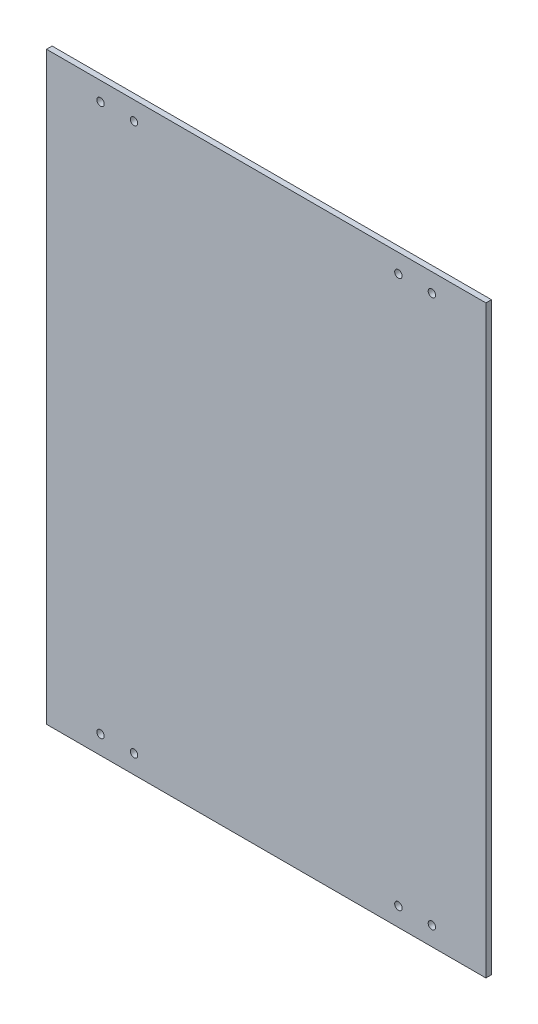
from build123d import *

# Parameters (mm, degrees)
ESQUISSE1_W             = 236
ESQUISSE1_H             = 314
BOSS_EXTRU_1_DEPTH      = 3
ENL_V_MAT_EXTRU_1_REACH = 200.829
ESQUISSE3_R             = 2


with BuildPart() as part:
    # Esquisse1 → Boss.-Extru.1 (new body)
    with BuildSketch(Plane.XY):
        with Locations((0, -3)):
            Rectangle(ESQUISSE1_W, ESQUISSE1_H)
    extrude(amount=BOSS_EXTRU_1_DEPTH)

    # Esquisse3 → Enlèv. mat.-Extru.1 (cut, up to next)
    with BuildSketch(Plane.XY.offset(3), mode=Mode.PRIVATE) as enl_v_mat_extru_1_sk1:
        with Locations((-71, -150)):
            Circle(ESQUISSE3_R)
    enl_v_mat_extru_1_tool1 = extrude(enl_v_mat_extru_1_sk1.sketch, amount=-ENL_V_MAT_EXTRU_1_REACH, mode=Mode.PRIVATE) & part.part
    # Esquisse3 → Enlèv. mat.-Extru.1 (cut, up to next)
    with BuildSketch(Plane.XY.offset(3), mode=Mode.PRIVATE) as enl_v_mat_extru_1_sk2:
        with Locations((-89, -150)):
            Circle(ESQUISSE3_R)
    enl_v_mat_extru_1_tool2 = extrude(enl_v_mat_extru_1_sk2.sketch, amount=-ENL_V_MAT_EXTRU_1_REACH, mode=Mode.PRIVATE) & part.part
    # Esquisse3 → Enlèv. mat.-Extru.1 (cut, up to next)
    with BuildSketch(Plane.XY.offset(3), mode=Mode.PRIVATE) as enl_v_mat_extru_1_sk3:
        with Locations((-89, 144)):
            Circle(ESQUISSE3_R)
    enl_v_mat_extru_1_tool3 = extrude(enl_v_mat_extru_1_sk3.sketch, amount=-ENL_V_MAT_EXTRU_1_REACH, mode=Mode.PRIVATE) & part.part
    # Esquisse3 → Enlèv. mat.-Extru.1 (cut, up to next)
    with BuildSketch(Plane.XY.offset(3), mode=Mode.PRIVATE) as enl_v_mat_extru_1_sk4:
        with Locations((-71, 144)):
            Circle(ESQUISSE3_R)
    enl_v_mat_extru_1_tool4 = extrude(enl_v_mat_extru_1_sk4.sketch, amount=-ENL_V_MAT_EXTRU_1_REACH, mode=Mode.PRIVATE) & part.part
    # Esquisse3 → Enlèv. mat.-Extru.1 (cut, up to next)
    with BuildSketch(Plane.XY.offset(3), mode=Mode.PRIVATE) as enl_v_mat_extru_1_sk5:
        with Locations((71, 144)):
            Circle(ESQUISSE3_R)
    enl_v_mat_extru_1_tool5 = extrude(enl_v_mat_extru_1_sk5.sketch, amount=-ENL_V_MAT_EXTRU_1_REACH, mode=Mode.PRIVATE) & part.part
    # Esquisse3 → Enlèv. mat.-Extru.1 (cut, up to next)
    with BuildSketch(Plane.XY.offset(3), mode=Mode.PRIVATE) as enl_v_mat_extru_1_sk6:
        with Locations((89, 144)):
            Circle(ESQUISSE3_R)
    enl_v_mat_extru_1_tool6 = extrude(enl_v_mat_extru_1_sk6.sketch, amount=-ENL_V_MAT_EXTRU_1_REACH, mode=Mode.PRIVATE) & part.part
    enl_v_mat_extru_1_1 = enl_v_mat_extru_1_tool1.solids().sort_by_distance((-71, -150, 3))[0]
    add(enl_v_mat_extru_1_1, mode=Mode.SUBTRACT)
    enl_v_mat_extru_1_2 = enl_v_mat_extru_1_tool2.solids().sort_by_distance((-89, -150, 3))[0]
    add(enl_v_mat_extru_1_2, mode=Mode.SUBTRACT)
    enl_v_mat_extru_1_3 = enl_v_mat_extru_1_tool3.solids().sort_by_distance((-89, 144, 3))[0]
    add(enl_v_mat_extru_1_3, mode=Mode.SUBTRACT)
    enl_v_mat_extru_1_4 = enl_v_mat_extru_1_tool4.solids().sort_by_distance((-71, 144, 3))[0]
    add(enl_v_mat_extru_1_4, mode=Mode.SUBTRACT)
    enl_v_mat_extru_1_5 = enl_v_mat_extru_1_tool5.solids().sort_by_distance((71, 144, 3))[0]
    add(enl_v_mat_extru_1_5, mode=Mode.SUBTRACT)
    enl_v_mat_extru_1_6 = enl_v_mat_extru_1_tool6.solids().sort_by_distance((89, 144, 3))[0]
    add(enl_v_mat_extru_1_6, mode=Mode.SUBTRACT)
    enl_v_mat_extru_1 = enl_v_mat_extru_1_1 + enl_v_mat_extru_1_2 + enl_v_mat_extru_1_3 + enl_v_mat_extru_1_4 + enl_v_mat_extru_1_5 + enl_v_mat_extru_1_6  # Enlèv. mat.-Extru.1 as one shape, for the pattern or mirror that repeats it

    # Symétrie1: Enlèv. mat.-Extru.1 across plane
    add(enl_v_mat_extru_1.mirror(Plane(origin=(0, 0, 0), x_dir=(0, 0, 1), z_dir=(1, 0, 0))), mode=Mode.SUBTRACT)


solid = part.part
